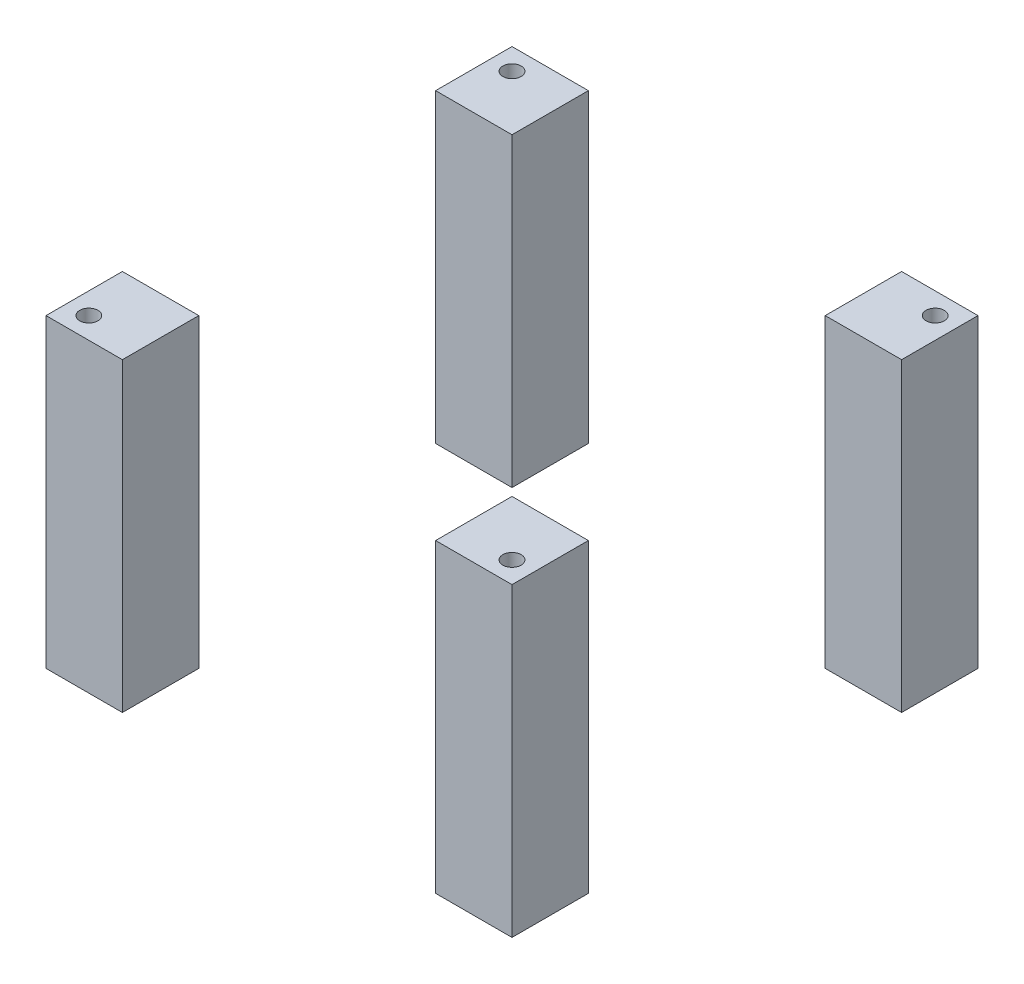
from build123d import *

# Parameters (mm, degrees)
SKETCH3_W               = 154.94
SKETCH3_H               = 154.94
BOSS_EXTRUDE3_DEPTH     = 6.35
SKETCH4_W               = 25.4
SKETCH4_H               = 25.4
BOSS_EXTRUDE4_DEPTH     = 101.6
SKETCH5_R               = 3.04
CUT_EXTRUDE1_DEPTH      = 19.05
CUT_EXTRUDE2_DEPTH      = 154.806385758
CUT_EXTRUDE2_DEPTH_BACK = 154.806385758


with BuildPart() as part:
    # Sketch3 → Boss-Extrude3 (new, symmetric)
    with BuildSketch(Plane(origin=(0, 0, 0), x_dir=(1, 0, 0), z_dir=(0, 1, 0))):
        Rectangle(SKETCH3_W, SKETCH3_H)
    extrude(amount=BOSS_EXTRUDE3_DEPTH, both=True)

    # Sketch4 → Boss-Extrude4 (add)
    with BuildSketch(Plane(origin=(0, 6.35, 0), x_dir=(1, 0, 0), z_dir=(0, 1, 0))):
        with Locations((-64.77, 64.77)):
            Rectangle(SKETCH4_W, SKETCH4_H)
        with Locations((64.77, 64.77)):
            Rectangle(SKETCH4_W, SKETCH4_H)
        with Locations((64.77, -64.77)):
            Rectangle(SKETCH4_W, SKETCH4_H)
        with Locations((-64.77, -64.77)):
            Rectangle(SKETCH4_W, SKETCH4_H)
    extrude(amount=BOSS_EXTRUDE4_DEPTH)

    # Sketch5 → Cut-Extrude1 (cut)
    with BuildSketch(Plane(origin=(0, 107.95, 0), x_dir=(1, 0, 0), z_dir=(0, 1, 0))):
        with Locations(Location((70.35005366, 70.35005366, 0), (0, 0, 270))):
            Circle(SKETCH5_R)
        with Locations(Location((-70.35005366, 70.35005366, 0), (0, 0, 270))):
            Circle(SKETCH5_R)
        with Locations(Location((-70.35005366, -70.35005366, 0), (0, 0, 270))):
            Circle(SKETCH5_R)
        with Locations(Location((70.35005366, -70.35005366, 0), (0, 0, 270))):
            Circle(SKETCH5_R)
    extrude(amount=-CUT_EXTRUDE1_DEPTH, mode=Mode.SUBTRACT)

    # Sketch6 → Cut-Extrude2 (cut, two sides: drawn at the far end of the back side and taken through both)
    with BuildSketch(Plane(origin=(0, 0, 0), x_dir=(0, 0, -1), z_dir=(1, 0, 0)).offset(-CUT_EXTRUDE2_DEPTH_BACK)):
        Polygon((-52.07, 6.35), (-77.47, 6.35), (-77.47, -6.35), (77.47, -6.35), (77.47, 6.35), (52.07, 6.35), align=None)
    extrude(amount=CUT_EXTRUDE2_DEPTH + CUT_EXTRUDE2_DEPTH_BACK, mode=Mode.SUBTRACT)


with BuildPart() as cut_extrude2_piece_1:
    # of the separate pieces the step leaves, piece 1, a body of its own (cut_extrude2_pieces)
    add(part.part.solids().sort_by_distance((-77.47, 107.95, -77.47))[0])


with BuildPart() as cut_extrude2_piece_2:
    # of the separate pieces the step leaves, piece 2, a body of its own (cut_extrude2_pieces)
    add(part.part.solids().sort_by_distance((52.07, 6.35, -77.47))[0])


with BuildPart() as cut_extrude2_piece_3:
    # of the separate pieces the step leaves, piece 3, a body of its own (cut_extrude2_pieces)
    add(part.part.solids().sort_by_distance((-77.47, 107.95, 77.47))[0])


with BuildPart() as cut_extrude2_piece_4:
    # of the separate pieces the step leaves, piece 4, a body of its own (cut_extrude2_pieces)
    add(part.part.solids().sort_by_distance((52.07, 6.35, 77.47))[0])


solid = Compound([cut_extrude2_piece_1.part, cut_extrude2_piece_2.part, cut_extrude2_piece_3.part, cut_extrude2_piece_4.part])
